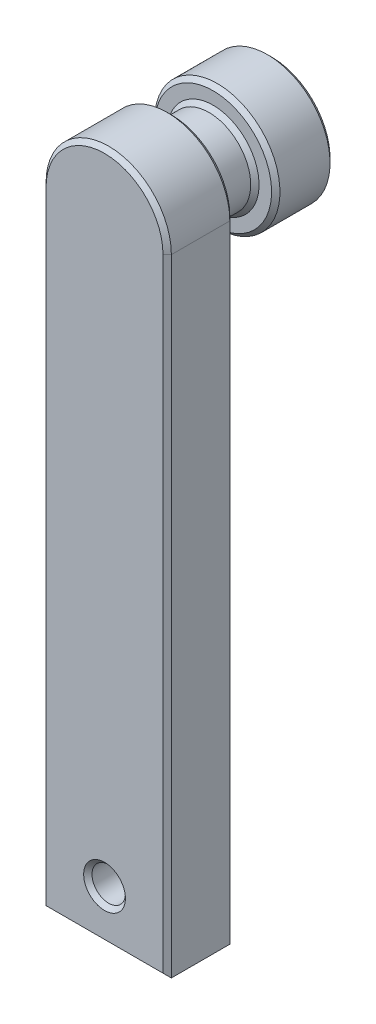
from build123d import *

# Parameters (mm, degrees)
SKETCH3_R           = 2
BOSS_EXTRUDE1_DEPTH = 8
SKETCH4_R           = 5
BOSS_EXTRUDE2_DEPTH = 5
BOSS_EXTRUDE3_START = 7
SKETCH5_R           = 7.5
BOSS_EXTRUDE3_DEPTH = 7
CHAMFER1_SIZE       = 0.5


with BuildPart() as part:
    # Sketch3 → Boss-Extrude1 (new body)
    with BuildSketch(Plane.XY):
        with BuildLine():
            Line((7.5, 75), (7.5, 0))
            Line((7.5, 0), (-7.5, 0))
            Line((-7.5, 0), (-7.5, 75))
            ThreePointArc((-7.5, 75), (0, 82.5), (7.5, 75))
        make_face()
        with Locations((0, 6)):
            Circle(SKETCH3_R, mode=Mode.SUBTRACT)
    extrude(amount=BOSS_EXTRUDE1_DEPTH)

    # Sketch4 → Boss-Extrude2 (add)
    with BuildSketch(Plane.XY):
        with Locations((0, 75)):
            Circle(SKETCH4_R)
    extrude(amount=-BOSS_EXTRUDE2_DEPTH)

    # Sketch5 → Boss-Extrude3 (add)
    with BuildSketch(Plane(origin=(0, 0, -5), x_dir=(-1, 0, 0), z_dir=(0, 0, -1)).offset(BOSS_EXTRUDE3_START)):
        with Locations((0, 75)):
            Circle(SKETCH5_R)
    extrude(amount=-BOSS_EXTRUDE3_DEPTH)

    # Chamfer1
    chamfer1_edges = [part.edges().sort_by_distance(p)[0] for p in [
        (-2, 6, 8),
        (7.5, 37.5, 8),
        (0, 82.5, 8),
        (-5, 75, 0),
        (-5, 75, -5),
        (7.5, 75, -5),
        (7.5, 75, -12),
        (-7.5, 37.5, 8),
        (0, 82.5, 0),
        (7.5, 37.5, 0),
        (0, 0, 0),
        (-7.5, 37.5, 0),
        (0, 0, 8),
    ]]
    chamfer(chamfer1_edges, length=CHAMFER1_SIZE)


solid = part.part
